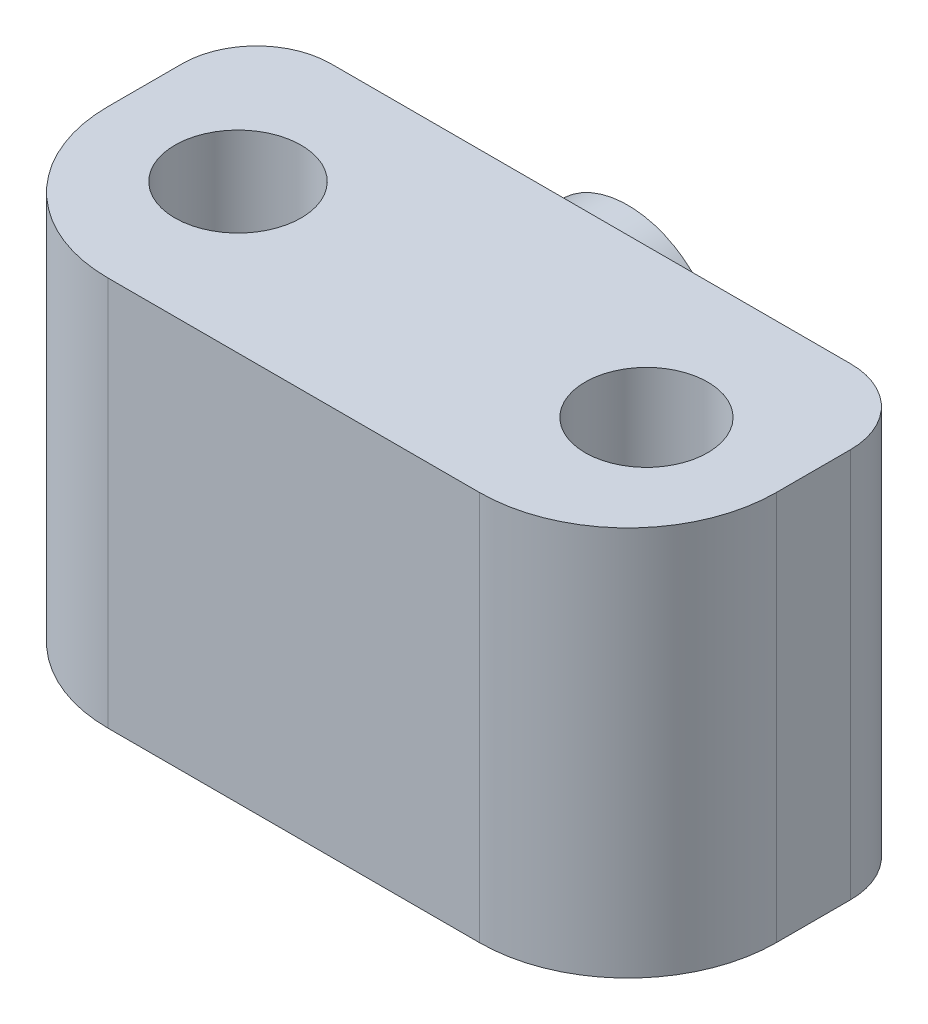
from build123d import *

# Parameters (mm, degrees)
SKETCH_1_W          = 18
SKETCH_1_H          = 12.5
EXTRUDE_1_DEPTH     = 8
SKETCH_2_R          = 1.625
CUT_EXTRUDE_1_DEPTH = 2.5
EXTRUDE_START       = 1
SKETCH_3_R          = 2.5
SKETCH_3_R_2        = 1.625
EXTRUDE_2_DEPTH     = 1
SKETCH_4_R          = 1.25
CUT_EXTRUDE_2_DEPTH = 25
FILLET_1_R          = 4
FILLET_2_R          = 2
CUT_EXTRUDE_3_DEPTH = 2
SKETCH_6_R          = 1.65
SKETCH_6_R_2        = 1.7
CUT_EXTRUDE_4_DEPTH = 8


with BuildPart() as part:
    # 草图1 → 凸台-拉伸1 (new body)
    with BuildSketch(Plane.XY):
        Rectangle(SKETCH_1_W, SKETCH_1_H)
    extrude(amount=EXTRUDE_1_DEPTH)

    # 草图2 → 切除-拉伸1 (cut, symmetric)
    with BuildSketch(Plane(origin=(0, 0, 0), x_dir=(-1, 0, 0), z_dir=(0, 0, -1))):
        with Locations((0, 1.45)):
            Circle(SKETCH_2_R)
    extrude(amount=CUT_EXTRUDE_1_DEPTH, both=True, mode=Mode.SUBTRACT)

    # 草图3 → 凸台-拉伸2 (add)
    with BuildSketch(Plane(origin=(0, 0, 0), x_dir=(-1, 0, 0), z_dir=(0, 0, -1)).offset(EXTRUDE_START)):
        with Locations(Location((0, 1.45, 0), (0, 0, 180))):
            Circle(SKETCH_3_R)
        with Locations((0, 1.45)):
            Circle(SKETCH_3_R_2, mode=Mode.SUBTRACT)
    extrude(amount=-EXTRUDE_2_DEPTH)

    # 草图4 → 切除-拉伸2 (cut)
    with BuildSketch(Plane(origin=(0, 6.25, 0), x_dir=(1, 0, 0), z_dir=(0, 1, 0))):
        with Locations(Location((-5.5, -4, 0), (0, 0, 270))):
            Circle(SKETCH_4_R)
    cut_extrude_2 = extrude(amount=-CUT_EXTRUDE_2_DEPTH, mode=Mode.SUBTRACT)

    # 镜向1: 切除-拉伸2 across plane
    add(cut_extrude_2.mirror(Plane(origin=(0, 0, 0), x_dir=(0, 0, 1), z_dir=(1, 0, 0))), mode=Mode.SUBTRACT)

    # 圆角1
    fillet_1_edges = [part.edges().sort_by_distance(p)[0] for p in [
        (-9, 0, 8),
        (9, 0, 8),
    ]]
    fillet(fillet_1_edges, radius=FILLET_1_R)

    # 圆角2
    fillet_2_edges = [part.edges().sort_by_distance(p)[0] for p in [
        (-9, 0, 0),
        (9, 0, 0),
    ]]
    fillet(fillet_2_edges, radius=FILLET_2_R)

    # 草图5 → 切除-拉伸3 (cut)
    with BuildSketch(Plane(origin=(0, 6.25, 0), x_dir=(1, 0, 0), z_dir=(0, 1, 0))):
        with BuildLine():
            Line((7, 0), (-7, 0))
            ThreePointArc((-7, 0), (-8.414213562, -0.585786438), (-9, -2))
            Line((-9, -2), (-9, -4))
            ThreePointArc((-9, -4), (-7.828427125, -6.828427125), (-5, -8))
            Line((-5, -8), (5, -8))
            ThreePointArc((5, -8), (7.828427125, -6.828427125), (9, -4))
            Line((9, -4), (9, -2))
            ThreePointArc((9, -2), (8.414213562, -0.585786438), (7, 0))
        make_face()
    extrude(amount=-CUT_EXTRUDE_3_DEPTH, mode=Mode.SUBTRACT)

    # 草图6 → 切除-拉伸4 (cut)
    with BuildSketch(Plane(origin=(0, 4.25, 0), x_dir=(1, 0, 0), z_dir=(0, 1, 0))):
        with Locations(Location((5.5, -4, 0), (0, 0, 270))):
            Circle(SKETCH_6_R)
        with Locations(Location((-5.5, -4, 0), (0, 0, 270))):
            Circle(SKETCH_6_R_2)
    extrude(amount=-CUT_EXTRUDE_4_DEPTH, mode=Mode.SUBTRACT)


solid = part.part
